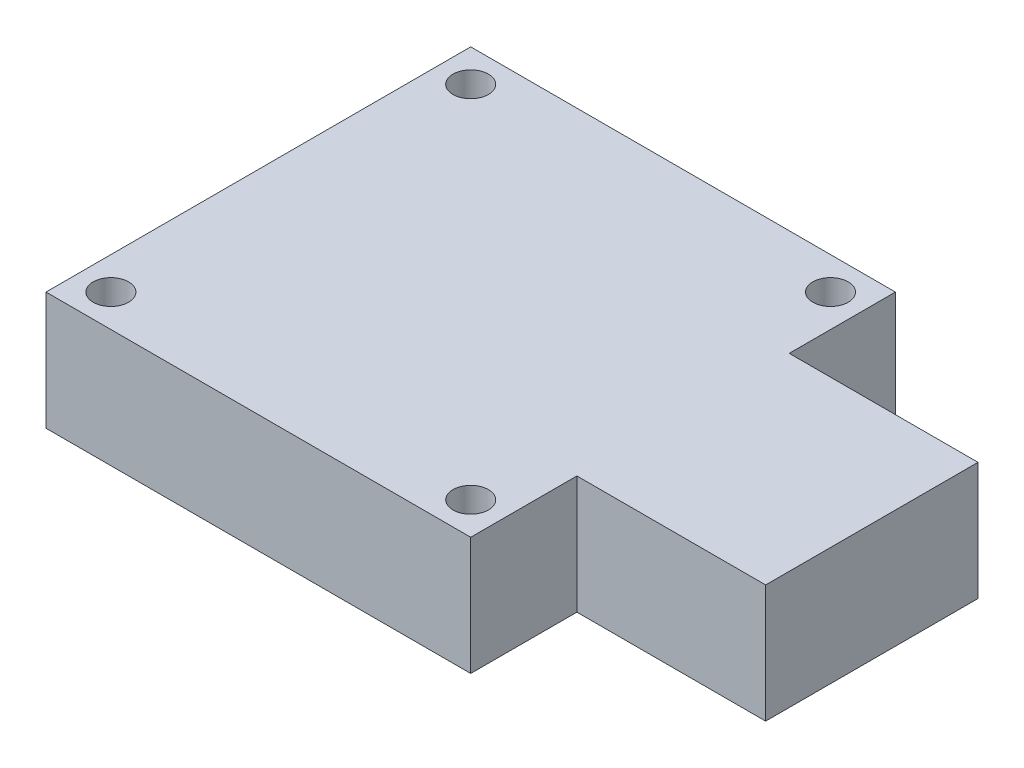
from build123d import *

# Parameters (mm, degrees)
BOSS_EXTRUDE1_DEPTH = 10
SKETCH2_R           = 1.5
CUT_EXTRUDE1_DEPTH  = 10


with BuildPart() as part:
    # Sketch1 → Boss-Extrude1 (new body)
    with BuildSketch(Plane(origin=(0, 0, 0), x_dir=(1, 0, 0), z_dir=(0, 1, 0))):
        Polygon((18, -9), (18, -18), (-18, -18), (-18, 18), (18, 18), (18, 9), (34, 9), (34, -9), align=None)
    extrude(amount=BOSS_EXTRUDE1_DEPTH)

    # Sketch2 → Cut-Extrude1 (cut)
    with BuildSketch(Plane(origin=(0, 10, 0), x_dir=(1, 0, 0), z_dir=(0, 1, 0))):
        with Locations(Location((-15.25, 15.25, 0), (0, 0, 270))):
            Circle(SKETCH2_R)
        with Locations(Location((15.25, 15.25, 0), (0, 0, 270))):
            Circle(SKETCH2_R)
        with Locations(Location((-15.25, -15.25, 0), (0, 0, 270))):
            Circle(SKETCH2_R)
        with Locations(Location((15.25, -15.25, 0), (0, 0, 270))):
            Circle(SKETCH2_R)
    extrude(amount=-CUT_EXTRUDE1_DEPTH, mode=Mode.SUBTRACT)


solid = part.part
